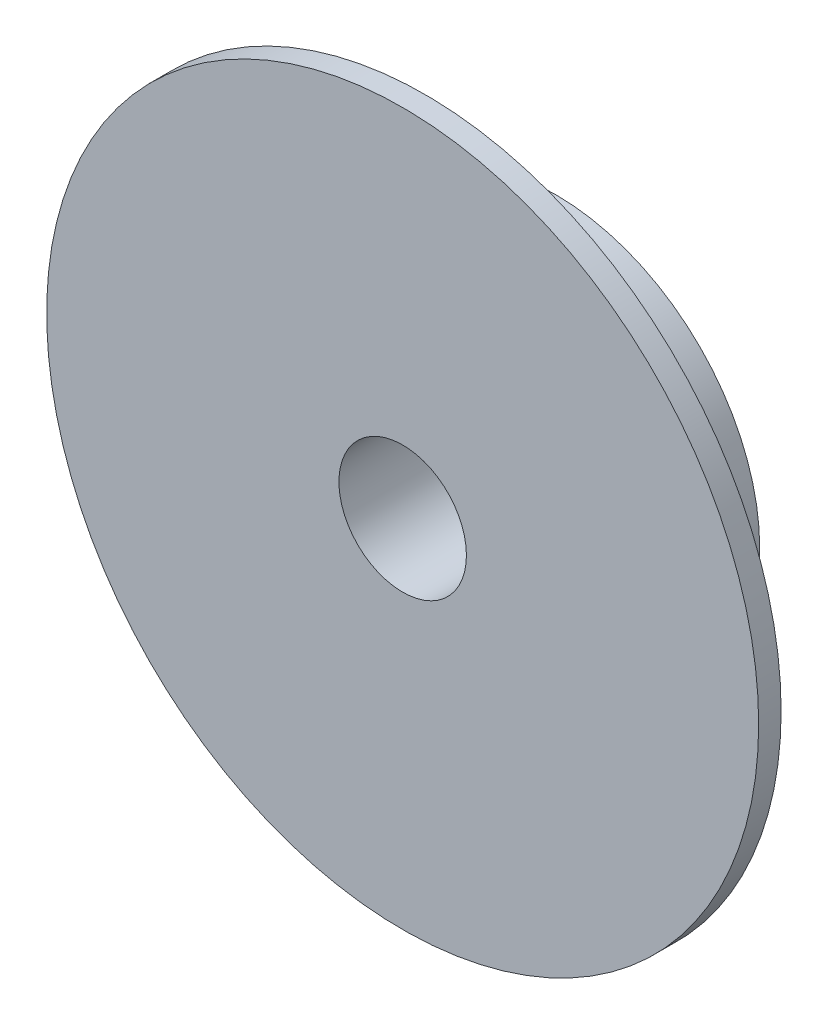
from build123d import *

# Parameters (mm, degrees)
SKETCH1_R           = 44.323
BOSS_EXTRUDE1_DEPTH = 2.794
SKETCH2_R           = 25.4
BOSS_EXTRUDE2_DEPTH = 16.256
SKETCH3_R           = 7.9375
CUT_EXTRUDE1_DEPTH  = 66.513045708


with BuildPart() as part:
    # Sketch1 → Boss-Extrude1 (new body)
    with BuildSketch(Plane.XY):
        Circle(SKETCH1_R)
    extrude(amount=BOSS_EXTRUDE1_DEPTH)

    # Sketch2 → Boss-Extrude2 (add)
    with BuildSketch(Plane(origin=(0, 0, 0), x_dir=(-1, 0, 0), z_dir=(0, 0, -1))):
        with Locations(Location((0, 0, 0), (0, 0, 180))):
            Circle(SKETCH2_R)
    extrude(amount=BOSS_EXTRUDE2_DEPTH)

    # Sketch3 → Cut-Extrude1 (cut, through all)
    with BuildSketch(Plane.XY.offset(2.794)):
        Circle(SKETCH3_R)
    extrude(amount=-CUT_EXTRUDE1_DEPTH, mode=Mode.SUBTRACT)


solid = part.part
